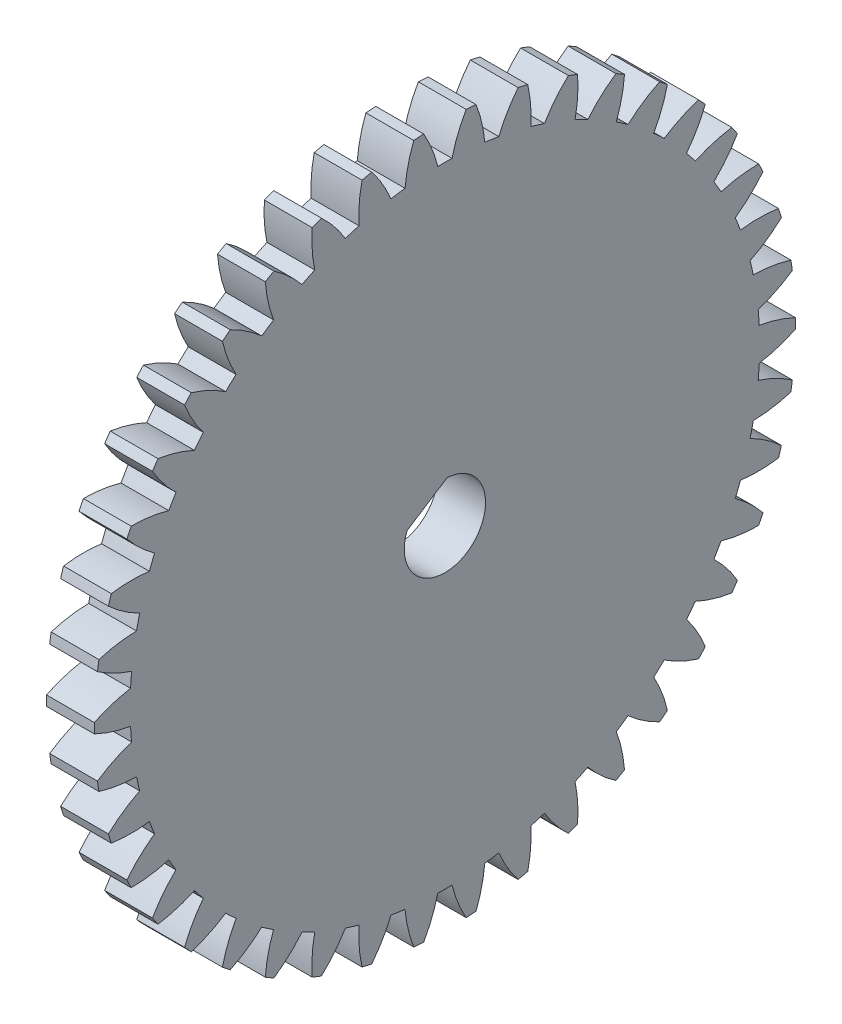
from build123d import *

# Parameters (mm, degrees)
BASPROSKE_W     = 3
BASPROSKE_H     = 22
TOOTHCUT_DEPTH  = 32.256999216
TEETHCUTS_COUNT = 42
TEETHCUTS_ANGLE = 351.428571429
BORE_DEPTH      = 50.0000508


with BuildPart() as part:
    # BasProSke → Base-Revolve (revolve)
    with BuildSketch(Plane(origin=(0, 0, 0), x_dir=(1, 0, 0), z_dir=(0, 1, 0)), mode=Mode.PRIVATE) as base_revolve_sk:
        with Locations((1.5, 11)):
            Rectangle(BASPROSKE_W, BASPROSKE_H)
    revolve(base_revolve_sk.sketch.rotate(Axis((-10, 0, 0), (1, 0, 0)), 180), axis=Axis((-10, 0, 0), (1, 0, 0)))

    # TooCutSke → ToothCut (cut, through all)
    with BuildSketch(Plane(origin=(0, 0, 0), x_dir=(0, 0, -1), z_dir=(1, 0, 0))):
        with BuildLine():
            ThreePointArc((0.446078735, 19.743961476), (0, 19.749), (-0.446078735, 19.743961476))
            ThreePointArc((-0.446078735, 19.743961476), (-0.816459964, 20.896623713), (-1.348697399, 21.984068333))
            ThreePointArc((-1.348697399, 21.984068333), (0, 22.0254), (1.348697399, 21.984068333))
            ThreePointArc((1.348697399, 21.984068333), (0.816459964, 20.896623713), (0.446078735, 19.743961476))
        make_face()
    toothcut = extrude(amount=TOOTHCUT_DEPTH, mode=Mode.SUBTRACT)

    # TeethCuts: ToothCut ×42 about axis
    teethcuts_axis = Axis((-10, 0, 0), (1, 0, 0))
    for i in range(1, TEETHCUTS_COUNT):
        add(toothcut.rotate(teethcuts_axis, i * TEETHCUTS_ANGLE / (TEETHCUTS_COUNT - 1)), mode=Mode.SUBTRACT)

    # BorSke → Bore (cut, symmetric)
    with BuildSketch(Plane(origin=(0, 0, 0), x_dir=(0, 0, -1), z_dir=(1, 0, 0))):
        with BuildLine():
            Line((-2.380025775, 0.915411007), (0.137972733, 2.546264622))
            ThreePointArc((0.137972733, 2.546264622), (1.386225573, -2.140298732), (-2.380025775, 0.915411007))
        make_face()
    extrude(amount=BORE_DEPTH, both=True, mode=Mode.SUBTRACT)


solid = part.part
